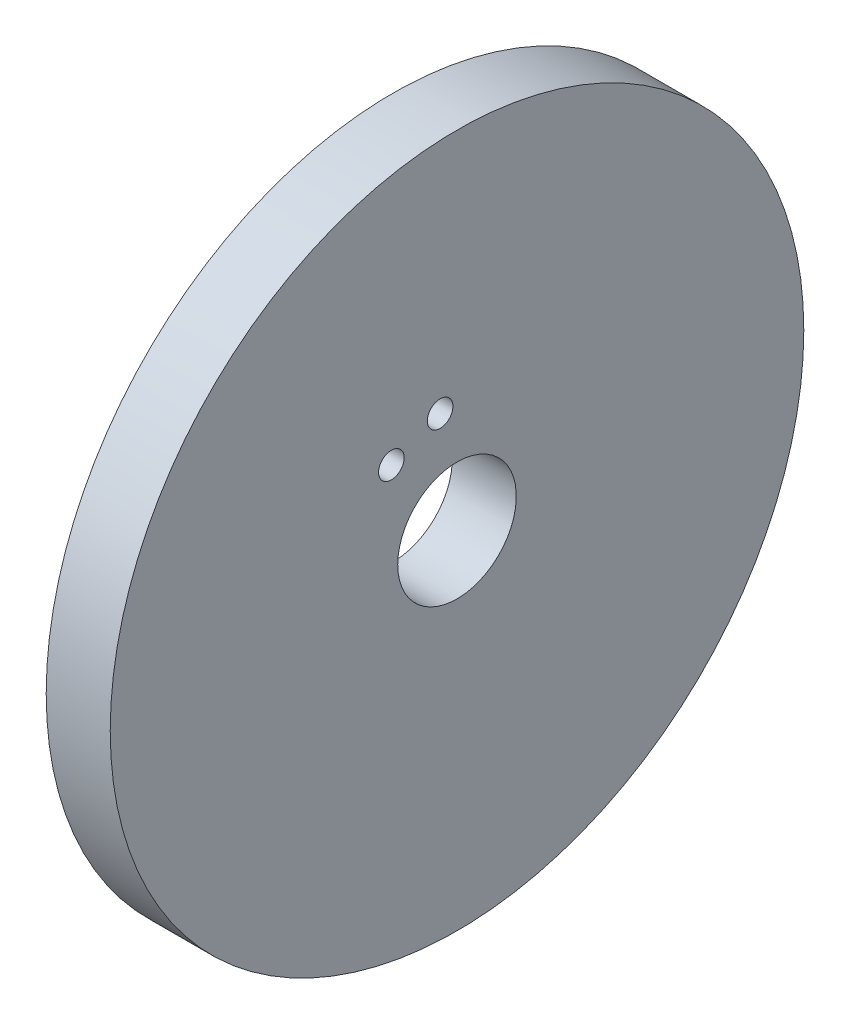
from build123d import *

# Parameters (mm, degrees)
AXIAL_PROFILE_MM_W     = 12
AXIAL_PROFILE_MM_H     = 53.8875
AXIAL_HOLES_DEPTH      = 96.448886845
AXIAL_HOLES_DEPTH_BACK = 96.448886845
SKETCH2_R              = 2.4
CUT_EXTRUDE2_START     = 13.7
SKETCH3_R              = 1.3
CUT_EXTRUDE2_DEPTH     = 7


with BuildPart() as part:
    # Axial profile (mm) → Full revolution (revolve)
    with BuildSketch(Plane.XY, mode=Mode.PRIVATE) as full_revolution_sk:
        with Locations((19.7, 38.05625)):
            Rectangle(AXIAL_PROFILE_MM_W, AXIAL_PROFILE_MM_H)
    revolve(full_revolution_sk.sketch.rotate(Axis((-110, 0, 0), (1, 0, 0)), 90), axis=Axis((-110, 0, 0), (1, 0, 0)))

    # Sketch2 → Axial holes (cut, two sides: drawn at the far end of the back side and taken through both)
    with BuildSketch(Plane(origin=(0, 0, 0), x_dir=(0, 0, -1), z_dir=(1, 0, 0)).offset(-AXIAL_HOLES_DEPTH_BACK)):
        with Locations((-3.163812264, 20.557973926)):
            Circle(SKETCH2_R)
        with Locations((-12.299529665, 16.773835877)):
            Circle(SKETCH2_R)
    extrude(amount=AXIAL_HOLES_DEPTH + AXIAL_HOLES_DEPTH_BACK, mode=Mode.SUBTRACT)

    # Sketch3 → Cut-Extrude2 (cut)
    with BuildSketch(Plane(origin=(0, 0, 0), x_dir=(0, 0, -1), z_dir=(1, 0, 0)).offset(CUT_EXTRUDE2_START)):
        with Locations((-34.648232278, 34.648232278)):
            Circle(SKETCH3_R)
        with Locations((-34.648232278, -34.648232278)):
            Circle(SKETCH3_R)
        with Locations((34.648232278, -34.648232278)):
            Circle(SKETCH3_R)
        with Locations((34.648232278, 34.648232278)):
            Circle(SKETCH3_R)
    extrude(amount=CUT_EXTRUDE2_DEPTH, mode=Mode.SUBTRACT)


solid = part.part
